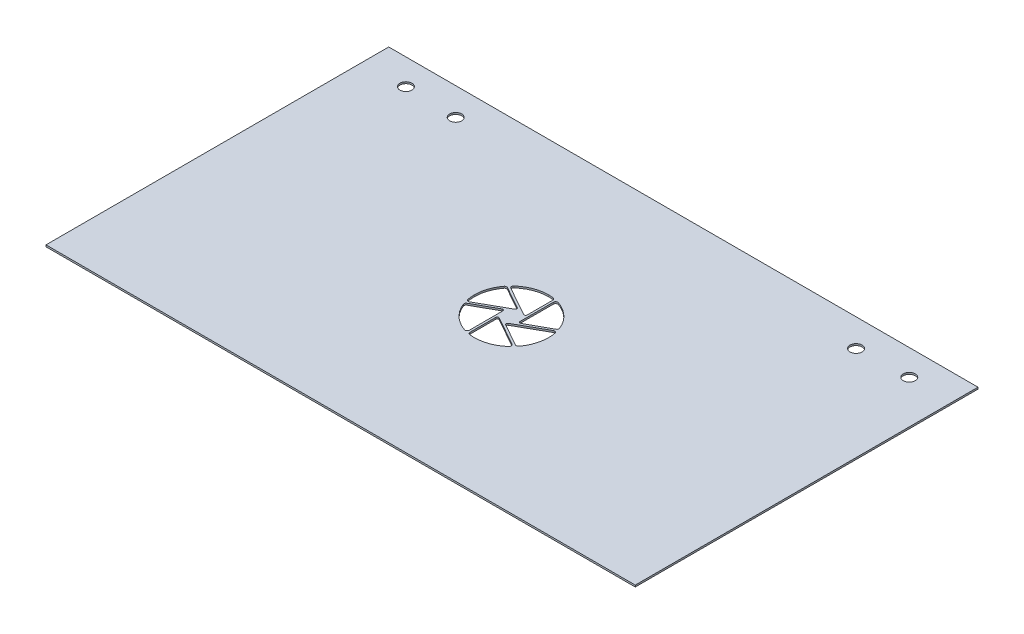
from build123d import *

# Parameters (mm, degrees)
SKETCH1_W            = 343
SKETCH1_H            = 199.5
BOSS_EXTRUDE1_DEPTH  = 1
M6_CLEARANCE_HOLE1_D = 7


with BuildPart() as part:
    # Sketch1 → Boss-Extrude1 (new body)
    with BuildSketch(Plane(origin=(0, 0, 0), x_dir=(1, 0, 0), z_dir=(0, 1, 0))):
        with Locations((11.41106981, 0.534905995)):
            Rectangle(SKETCH1_W, SKETCH1_H)
        with BuildLine():
            Line((-7.985757833, -4.648175221), (8.711031725, 4.759089682))
            add(Edge.make_bspline(
                [(8.711031725, 4.759089682), (9.311815171, 5.097749627), (9.310461275, 5.963705422), (8.708323934, 6.300339691)],
                knots=[5, 5, 5, 5, 6, 6, 6, 6], degree=3))
            Line((8.708323934, 6.300339691), (-4.290635533, 13.569700018))
            add(Edge.make_bspline(
                [(-4.290635533, 13.569700018), (-4.841299002, 13.877540751), (-5.535211865, 13.729542386), (-5.914514518, 13.224942375)],
                knots=[0, 0, 0, 0, 1, 1, 1, 1], degree=3))
            add(Edge.make_bspline(
                [(-5.914514518, 13.224942375), (-8.626837761, 9.614826119), (-10.237508511, 5.130289637), (-10.237508511, 0.267137786)],
                knots=[1, 1, 1, 1, 2, 2, 2, 2], degree=3))
            add(Edge.make_bspline(
                [(-10.237508511, 0.267137786), (-10.237508511, -1.12306501), (-10.095266787, -2.478045848), (-9.837887089, -3.792378812)],
                knots=[2, 2, 2, 2, 3, 3, 3, 3], degree=3))
            add(Edge.make_bspline(
                [(-9.837887089, -3.792378812), (-9.673300918, -4.634295207), (-8.732839522, -5.069133419), (-7.985757833, -4.648175221)],
                knots=[3, 3, 3, 3, 4, 4, 4, 4], degree=3))
        make_face(mode=Mode.SUBTRACT)
        with BuildLine():
            Line((17.789899426, -0.591423265), (30.86115737, 6.677229102))
            add(Edge.make_bspline(
                [(30.86115737, 6.677229102), (31.413846515, 6.984728777), (31.653279344, 7.656292027), (31.419262097, 8.244213464)],
                knots=[1, 1, 1, 1, 2, 2, 2, 2], degree=3))
            add(Edge.make_bspline(
                [(31.419262097, 8.244213464), (29.075058949, 14.133504536), (24.219017634, 18.737245846), (18.168855853, 20.745837898)],
                knots=[2, 2, 2, 2, 3, 3, 3, 3], degree=3))
            add(Edge.make_bspline(
                [(18.168855853, 20.745837898), (17.350994359, 21.017443836), (16.504344496, 20.419714407), (16.502990601, 19.558161356)],
                knots=[3, 3, 3, 3, 4, 4, 4, 4], degree=3))
            Line((16.502990601, 19.558161356), (16.476574133, 0.182074892))
            add(Edge.make_bspline(
                [(16.476574133, 0.182074892), (16.475897185, -0.492537207), (17.200288203, -0.919252045), (17.789899426, -0.591423265)],
                knots=[5, 5, 5, 5, 6, 6, 6, 6], degree=3))
        make_face(mode=Mode.SUBTRACT)
        with BuildLine():
            Line((14.008386181, -5.768334993), (27.011157828, -13.039827191))
            add(Edge.make_bspline(
                [(27.011157828, -13.039827191), (27.561480239, -13.347667924), (28.25539827, -13.199679894), (28.634354697, -12.695410606)],
                knots=[1, 1, 1, 1, 2, 2, 2, 2], degree=3))
            add(Edge.make_bspline(
                [(28.634354697, -12.695410606), (31.349401234, -9.084963628), (32.961756602, -4.598391135), (32.961756602, 0.267137786)],
                knots=[2, 2, 2, 2, 3, 3, 3, 3], degree=3))
            add(Edge.make_bspline(
                [(32.961756602, 0.267137786), (32.961756602, 1.665463955), (32.818160982, 3.02822711), (32.558068326, 4.350022002)],
                knots=[3, 3, 3, 3, 4, 4, 4, 4], degree=3))
            add(Edge.make_bspline(
                [(32.558068326, 4.350022002), (32.392469317, 5.191587005), (31.451666864, 5.626094494), (30.704585174, 5.204123458)],
                knots=[4, 4, 4, 4, 5, 5, 5, 5], degree=3))
            Line((30.704585174, 5.204123458), (14.004996275, -4.227436377))
            add(Edge.make_bspline(
                [(14.004996275, -4.227436377), (13.404889777, -4.56643738), (13.40658473, -5.431711059), (14.008386181, -5.768334993)],
                knots=[6, 6, 6, 6, 7, 7, 7, 7], degree=3))
        make_face(mode=Mode.SUBTRACT)
        with BuildLine():
            Line((15.306606753, 5.498905809), (15.306606753, 20.417885097))
            add(Edge.make_bspline(
                [(15.306606753, 20.417885097), (15.306606753, 21.047115854), (14.841962166, 21.580168344), (14.218829107, 21.665846168)],
                knots=[1, 1, 1, 1, 2, 2, 2, 2], degree=3))
            add(Edge.make_bspline(
                [(14.218829107, 21.665846168), (13.284129519, 21.794538601), (12.331813785, 21.867018527), (11.362233297, 21.867018527)],
                knots=[2, 2, 2, 2, 3, 3, 3, 3], degree=3))
            add(Edge.make_bspline(
                [(11.362233297, 21.867018527), (5.758087119, 21.867018527), (0.665320765, 19.719905379), (-3.170684195, 16.217149949)],
                knots=[3, 3, 3, 3, 4, 4, 4, 4], degree=3))
            add(Edge.make_bspline(
                [(-3.170684195, 16.217149949), (-3.804989477, 15.638044336), (-3.687474435, 14.607502371), (-2.938020844, 14.188580184)],
                knots=[4, 4, 4, 4, 5, 5, 5, 5], degree=3))
            Line((-2.938020844, 14.188580184), (13.991927564, 4.727433328))
            add(Edge.make_bspline(
                [(13.991927564, 4.727433328), (14.580856672, 4.398260987), (15.306606753, 4.823952653), (15.306606753, 5.498905809)],
                knots=[6, 6, 6, 6, 7, 7, 7, 7], degree=3))
        make_face(mode=Mode.SUBTRACT)
        with BuildLine():
            Line((7.357446123, -4.930131749), (7.357446123, -19.87689174))
            add(Edge.make_bspline(
                [(7.357446123, -19.87689174), (7.357787181, -20.505445549), (7.821408594, -21.037815923), (8.443869873, -21.124852811)],
                knots=[1, 1, 1, 1, 2, 2, 2, 2], degree=3))
            add(Edge.make_bspline(
                [(8.443869873, -21.124852811), (9.397870225, -21.257947988), (10.37084062, -21.332112532), (11.361763051, -21.332112532)],
                knots=[2, 2, 2, 2, 3, 3, 3, 3], degree=3))
            add(Edge.make_bspline(
                [(11.361763051, -21.332112532), (16.964214275, -21.332112532), (22.054608728, -19.186699506), (25.890267463, -15.686310809)],
                knots=[3, 3, 3, 3, 4, 4, 4, 4], degree=3))
            add(Edge.make_bspline(
                [(25.890267463, -15.686310809), (26.52458308, -15.107541086), (26.407403928, -14.076663231), (25.657955505, -13.657405154)],
                knots=[4, 4, 4, 4, 5, 5, 5, 5], degree=3))
            Line((25.657955505, -13.657405154), (8.672461202, -4.158669603))
            add(Edge.make_bspline(
                [(8.672461202, -4.158669603), (8.083532094, -3.829486928), (7.357446123, -4.255188928), (7.357446123, -4.930131749)],
                knots=[6, 6, 6, 6, 7, 7, 7, 7], degree=3))
        make_face(mode=Mode.SUBTRACT)
        with BuildLine():
            Line((4.847907511, 1.148952756), (-8.149526948, -6.119709946))
            add(Edge.make_bspline(
                [(-8.149526948, -6.119709946), (-8.700185249, -6.427891736), (-8.938264182, -7.097418975), (-8.705605999, -7.683976181)],
                knots=[1, 1, 1, 1, 2, 2, 2, 2], degree=3))
            add(Edge.make_bspline(
                [(-8.705605999, -7.683976181), (-6.373928969, -13.563789984), (-1.538542313, -18.16516456), (4.489941634, -20.188659799)],
                knots=[2, 2, 2, 2, 3, 3, 3, 3], degree=3))
            add(Edge.make_bspline(
                [(4.489941634, -20.188659799), (5.308821133, -20.463650476), (6.158855735, -19.864220926), (6.158855735, -19.000637033)],
                knots=[3, 3, 3, 3, 4, 4, 4, 4], degree=3))
            Line((6.158855735, -19.000637033), (6.16292259, 0.377480275))
            add(Edge.make_bspline(
                [(6.16292259, 0.377480275), (6.16325848, 1.052433432), (5.437172508, 1.478466155), (4.847907511, 1.148952756)],
                knots=[5, 5, 5, 5, 6, 6, 6, 6], degree=3))
        make_face(mode=Mode.SUBTRACT)
    extrude(amount=BOSS_EXTRUDE1_DEPTH)

    # M6 Clearance Hole1 (through all)
    with Locations(Plane(origin=(-135.08893019, 1, -85.284905995), x_dir=(0, 0, 1), z_dir=(0, 1, 0))):
        with Locations((0, 0), (0.999444907, 29.983347209), (0.999444907, 263.016652791), (0, 293)):
            Hole(M6_CLEARANCE_HOLE1_D / 2)


solid = part.part
